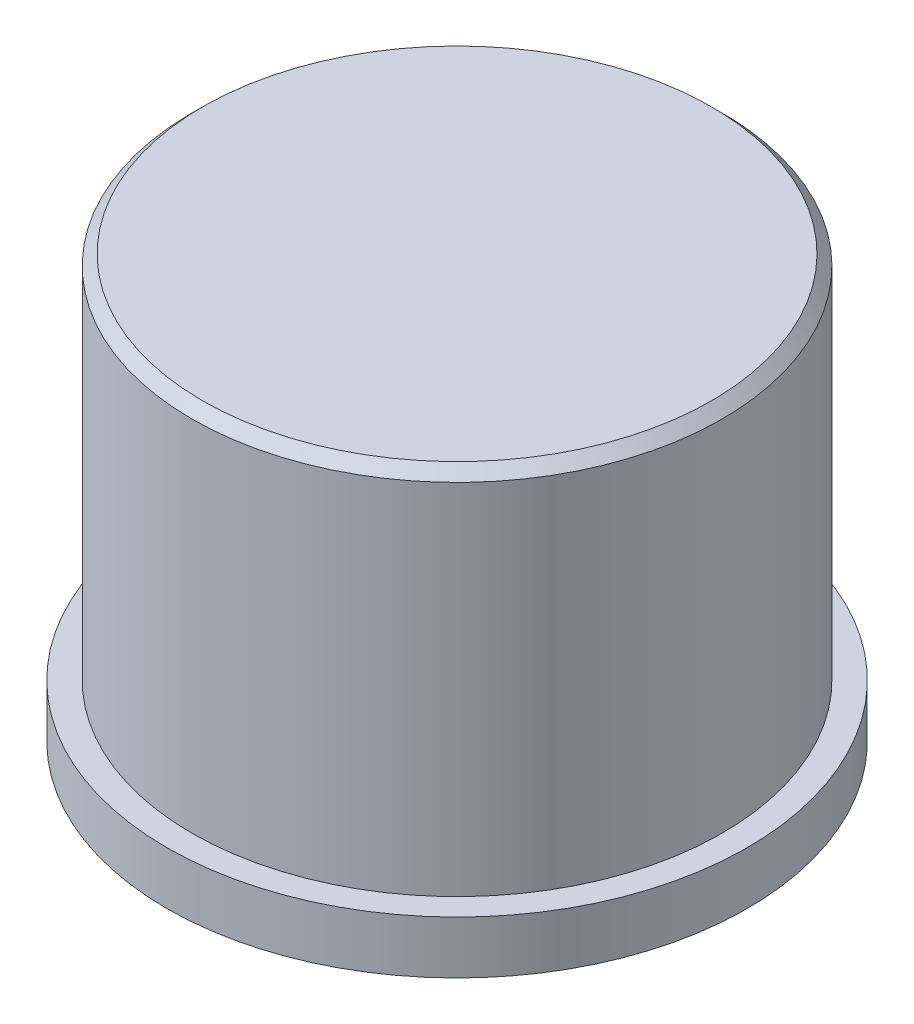
from build123d import *

# Parameters (mm, degrees)
SKETCH1_R           = 5.5
BOSS_EXTRUDE1_DEPTH = 1
SKETCH2_R           = 5.025
BOSS_EXTRUDE2_DEPTH = 7
CUT_EXTRUDE1_DEPTH  = 7
CHAMFER1_SIZE       = 0.2


with BuildPart() as part:
    # Sketch1 → Boss-Extrude1 (new body)
    with BuildSketch(Plane(origin=(0, 0, 0), x_dir=(1, 0, 0), z_dir=(0, 1, 0))):
        with Locations(Location((0, 0, 0), (0, 0, 270))):
            Circle(SKETCH1_R)
    extrude(amount=BOSS_EXTRUDE1_DEPTH)

    # Sketch2 → Boss-Extrude2 (add)
    with BuildSketch(Plane(origin=(0, 1, 0), x_dir=(1, 0, 0), z_dir=(0, 1, 0))):
        with Locations(Location((0, 0, 0), (0, 0, 270))):
            Circle(SKETCH2_R)
    extrude(amount=BOSS_EXTRUDE2_DEPTH)

    # Sketch3 → Cut-Extrude1 (cut)
    with BuildSketch(Plane.XZ):
        Polygon((3.0022214, 0), (1.5011107, 2.6), (-1.5011107, 2.6), (-3.0022214, 0), (-1.5011107, -2.6), (1.5011107, -2.6), align=None)
    extrude(amount=-CUT_EXTRUDE1_DEPTH, mode=Mode.SUBTRACT)

    # Chamfer1
    chamfer1_edges = [part.edges().sort_by_distance(p)[0] for p in [
        (0, 8, -5.025),
    ]]
    chamfer(chamfer1_edges, length=CHAMFER1_SIZE)


solid = part.part
